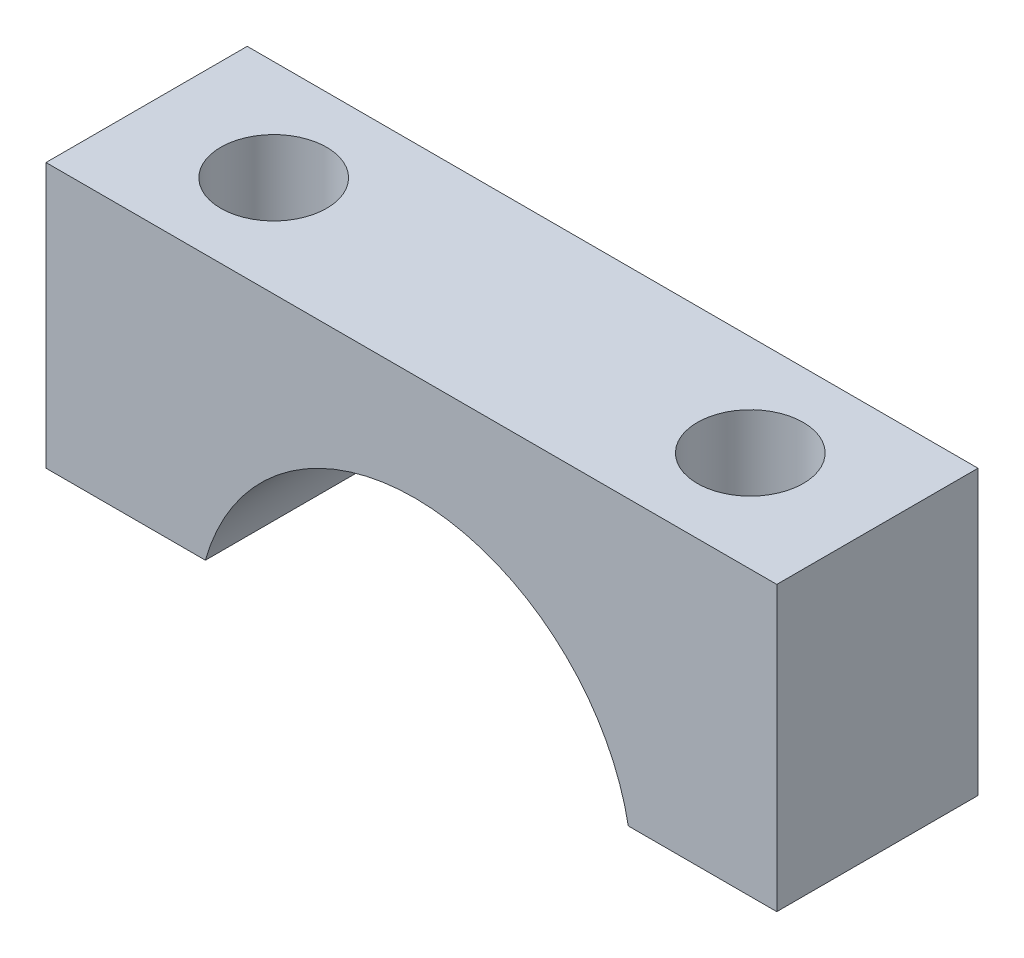
from build123d import *

# Parameters (mm, degrees)
BOSS_EXTRUDE1_DEPTH = 9.652
SKETCH2_R           = 2.54
CUT_EXTRUDE1_DEPTH  = 5.08


with BuildPart() as part:
    # Sketch1 → Boss-Extrude1 (new body)
    with BuildSketch(Plane.XY):
        with BuildLine():
            Line((2476.991807356, 1418.793197854), (2476.991807356, 1431.493197854))
            Line((2476.991807356, 1431.493197854), (2512.043807356, 1431.493197854))
            Line((2512.043807356, 1431.493197854), (2512.043807356, 1417.89780113))
            Line((2512.043807356, 1417.89780113), (2504.92216143, 1417.89780113))
            ThreePointArc((2504.92216143, 1417.89780113), (2495.135108983, 1426.393265728), (2484.637572003, 1418.793197854))
            Line((2484.637572003, 1418.793197854), (2476.991807356, 1418.793197854))
        make_face()
    extrude(amount=BOSS_EXTRUDE1_DEPTH)

    # Sketch2 → Cut-Extrude1 (cut)
    with BuildSketch(Plane(origin=(0, 1431.493197854, 0), x_dir=(1, 0, 0), z_dir=(0, 1, 0))):
        with Locations(Location((2483.087807356, -4.826, 0), (0, 0, 270))):
            Circle(SKETCH2_R)
        with Locations(Location((2505.947807356, -4.826, 0), (0, 0, 90))):
            Circle(SKETCH2_R)
    extrude(amount=-CUT_EXTRUDE1_DEPTH, mode=Mode.SUBTRACT)


solid = part.part
